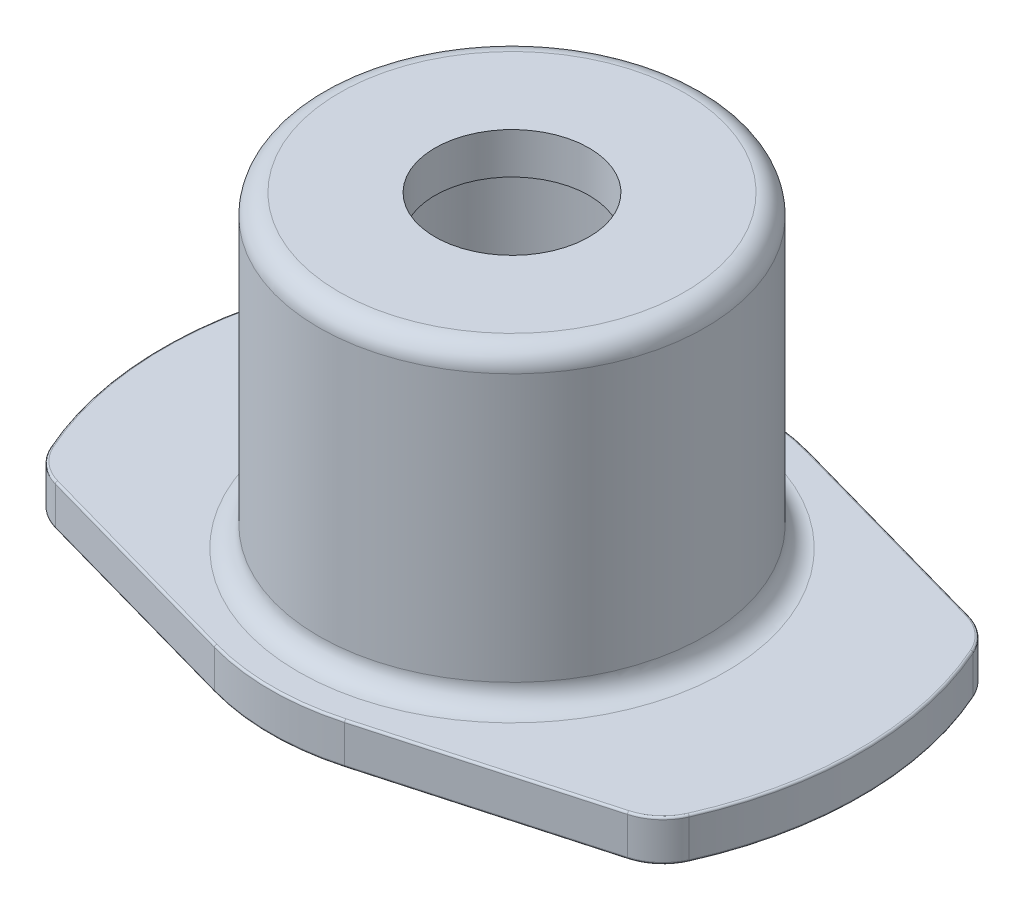
from build123d import *

# Parameters (mm, degrees)
BOSS_EXTRUDE3_DEPTH = 2
SKETCH2_R           = 9.4
BOSS_EXTRUDE2_DEPTH = 15
SKETCH3_R           = 5.105
CUT_EXTRUDE1_DEPTH  = 15
SKETCH4_R           = 3.75
CUT_EXTRUDE2_DEPTH  = 26.535514485
FILLET2_R           = 1
FILLET4_R           = 0.1


with BuildPart() as part:
    # Sketch6 → Boss-Extrude3 (new body)
    with BuildSketch(Plane(origin=(0, 0, 0), x_dir=(1, 0, 0), z_dir=(0, 1, 0))):
        with BuildLine():
            Line((-3.16984511, 11.314352919), (-13.922193144, 8.301959893))
            ThreePointArc((-13.922193144, 8.301959893), (-14.882365074, 7.78622676), (-15.531854224, 6.910969857))
            ThreePointArc((-15.531854224, 6.910969857), (-17, 0), (-15.531854224, -6.910969857))
            ThreePointArc((-15.531854224, -6.910969857), (-14.882365074, -7.78622676), (-13.922193144, -8.301959893))
            Line((-13.922193144, -8.301959893), (-3.16984511, -11.314352919))
            ThreePointArc((-3.16984511, -11.314352919), (0, -11.75), (3.16984511, -11.314352919))
            Line((3.16984511, -11.314352919), (13.922193144, -8.301959893))
            ThreePointArc((13.922193144, -8.301959893), (14.882365074, -7.78622676), (15.531854224, -6.910969857))
            ThreePointArc((15.531854224, -6.910969857), (17, 0), (15.531854224, 6.910969857))
            ThreePointArc((15.531854224, 6.910969857), (14.882365074, 7.78622676), (13.922193144, 8.301959893))
            Line((13.922193144, 8.301959893), (3.16984511, 11.314352919))
            ThreePointArc((3.16984511, 11.314352919), (0, 11.75), (-3.16984511, 11.314352919))
        make_face()
    extrude(amount=BOSS_EXTRUDE3_DEPTH)

    # Sketch2 → Boss-Extrude2 (add)
    with BuildSketch(Plane(origin=(0, 2, 0), x_dir=(1, 0, 0), z_dir=(0, 1, 0))):
        with Locations(Location((0, 0, 0), (0, 0, 90))):
            Circle(SKETCH2_R)
    extrude(amount=BOSS_EXTRUDE2_DEPTH)

    # Sketch3 → Cut-Extrude1 (cut)
    with BuildSketch(Plane.XZ):
        with Locations(Location((0, 0, 0), (0, 0, 270))):
            Circle(SKETCH3_R)
    extrude(amount=-CUT_EXTRUDE1_DEPTH, mode=Mode.SUBTRACT)

    # Sketch4 → Cut-Extrude2 (cut, through all)
    with BuildSketch(Plane.XZ.offset(-15)):
        with Locations(Location((0, 0, 0), (0, 0, 270))):
            Circle(SKETCH4_R)
    extrude(amount=-CUT_EXTRUDE2_DEPTH, mode=Mode.SUBTRACT)

    # Fillet2
    fillet2_edges = [part.edges().sort_by_distance(p)[0] for p in [
        (0, 2, 9.4),
        (0, 17, 9.4),
    ]]
    fillet(fillet2_edges, radius=FILLET2_R)

    # Fillet4
    fillet4_edges = [part.edges().sort_by_distance(p)[0] for p in [
        (0, 2, -11.75),
        (17, 0, 0),
        (14.882365074, 0, 7.78622676),
        (8.546019127, 0, 9.808156406),
        (0, 0, 11.75),
        (-8.546019127, 0, 9.808156406),
        (-14.882365074, 0, 7.78622676),
        (-8.546019127, 2, -9.808156406),
        (-17, 0, 0),
        (-14.882365074, 0, -7.78622676),
        (-8.546019127, 0, -9.808156406),
        (0, 0, -11.75),
        (8.546019127, 0, -9.808156406),
        (14.882365074, 0, -7.78622676),
        (-14.882365074, 2, -7.78622676),
        (-17, 2, 0),
        (-14.882365074, 2, 7.78622676),
        (-8.546019127, 2, 9.808156406),
        (0, 2, 11.75),
        (8.546019127, 2, 9.808156406),
        (14.882365074, 2, 7.78622676),
        (17, 2, 0),
        (14.882365074, 2, -7.78622676),
        (8.546019127, 2, -9.808156406),
    ]]
    fillet(fillet4_edges, radius=FILLET4_R)


solid = part.part
